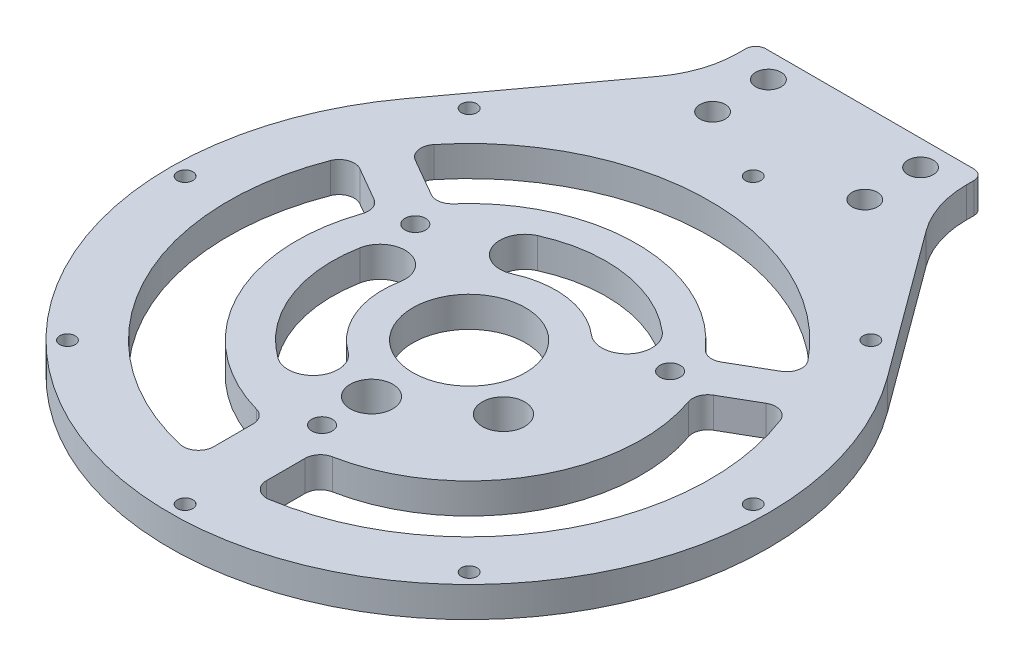
from build123d import *

# Parameters (mm, degrees)
SKETCH_1_R               = 59
SKETCH_1_R_2             = 11.1
EXTRUDE_1_DEPTH          = 6
SKETCH_2_R               = 1.525
CUT_EXTRUDE_1_DEPTH      = 6
EXTRUDE_START            = -6
EXTRUDE_2_DEPTH          = 6
SKETCH_4_R               = 4.2
SKETCH_4_R_2             = 2.025
CUT_EXTRUDE_2_DEPTH      = 6
SKETCH_5_R               = 4.2
CUT_EXTRUDE_3_DEPTH      = 6
CUT_EXTRUDE_4_DEPTH      = 10
CUT_EXTRUDE_5_DEPTH      = 10
CUT_EXTRUDE_7_DEPTH      = 10
FILLET_1_R               = 3
SKETCH_11_R              = 2.5
CUT_EXTRUDE_8_DEPTH      = 10
CUT_EXTRUDE_9_DEPTH      = 10
PATTERN_CIRCULAR_1_COUNT = 3
CUT_EXTRUDE_10_DEPTH     = 20
FILLET_3_R               = 20
FILLET_4_R               = 2


with BuildPart() as part:
    # 草图1 → 凸台-拉伸1 (new body)
    with BuildSketch(Plane(origin=(0, 0, 0), x_dir=(1, 0, 0), z_dir=(0, 1, 0))):
        with Locations(Location((0, 0, 0), (0, 0, 270))):
            Circle(SKETCH_1_R)
        with Locations(Location((0, 0, 0), (0, 0, 270))):
            Circle(SKETCH_1_R_2, mode=Mode.SUBTRACT)
    extrude(amount=EXTRUDE_1_DEPTH)

    # 草图2 → 切除-拉伸1 (cut)
    with BuildSketch(Plane(origin=(0, 6, 0), x_dir=(1, 0, 0), z_dir=(0, 1, 0))):
        with Locations(Location((0, 56, 0), (0, 0, 270))):
            Circle(SKETCH_2_R)
        with Locations(Location((39.597979746, 39.597979746, 0), (0, 0, 270))):
            Circle(SKETCH_2_R)
        with Locations(Location((56, 0, 0), (0, 0, 270))):
            Circle(SKETCH_2_R)
        with Locations(Location((39.597979746, -39.597979746, 0), (0, 0, 270))):
            Circle(SKETCH_2_R)
        with Locations(Location((0, -56, 0), (0, 0, 270))):
            Circle(SKETCH_2_R)
        with Locations(Location((-39.597979746, -39.597979746, 0), (0, 0, 270))):
            Circle(SKETCH_2_R)
        with Locations(Location((-56, 0, 0), (0, 0, 270))):
            Circle(SKETCH_2_R)
        with Locations(Location((-39.597979746, 39.597979746, 0), (0, 0, 270))):
            Circle(SKETCH_2_R)
    extrude(amount=-CUT_EXTRUDE_1_DEPTH, mode=Mode.SUBTRACT)

    # 草图3 → 凸台-拉伸2 (add)
    with BuildSketch(Plane(origin=(0, 6, 0), x_dir=(1, 0, 0), z_dir=(0, 1, 0)).offset(EXTRUDE_START)):
        with BuildLine():
            Line((-51.088050573, 29.512896989), (-22.5, 79))
            Line((-22.5, 79), (22.5, 79))
            Line((22.5, 79), (51.088050573, 29.512896989))
            ThreePointArc((51.088050573, 29.512896989), (0, 59), (-51.088050573, 29.512896989))
        make_face()
    extrude(amount=EXTRUDE_2_DEPTH)

    # 草图4 → 切除-拉伸2 (cut)
    with BuildSketch(Plane.XZ):
        with Locations(Location((0, 19.25, 0), (0, 0, 270))):
            Circle(SKETCH_4_R)
        with Locations(Location((0, 29, 0), (0, 0, 270))):
            Circle(SKETCH_4_R_2)
        with Locations(Location((25.11473671, -14.5, 0), (0, 0, 270))):
            Circle(SKETCH_4_R_2)
        with Locations(Location((-25.11473671, -14.5, 0), (0, 0, 270))):
            Circle(SKETCH_4_R_2)
    extrude(amount=-CUT_EXTRUDE_2_DEPTH, mode=Mode.SUBTRACT)

    # 草图5 → 切除-拉伸3 (cut)
    with BuildSketch(Plane.XZ):
        with Locations(Location((16.02146997, 9.25, 0), (0, 0, 270))):
            Circle(SKETCH_5_R)
    extrude(amount=-CUT_EXTRUDE_3_DEPTH, mode=Mode.SUBTRACT)

    # 草图8 → 切除-拉伸4 (cut)
    with BuildSketch(Plane.XZ):
        with BuildLine():
            Line((38.990090266, -27.129741264), (26.368115905, -19.842440969))
            ThreePointArc((26.368115905, -19.842440969), (0, -33), (-26.368115905, -19.842440969))
            Line((-26.368115905, -19.842440969), (-38.990090266, -27.129741264))
            ThreePointArc((-38.990090266, -27.129741264), (0, -47.5), (38.990090266, -27.129741264))
        make_face()
    extrude(amount=-CUT_EXTRUDE_4_DEPTH, mode=Mode.SUBTRACT)

    # 草图9 → 切除-拉伸5 (cut)
    with BuildSketch(Plane.XZ):
        with BuildLine():
            ThreePointArc((34, 0), (33.302950494, -6.849342188), (31.240383034, -13.417841401))
            Line((31.240383034, -13.417841401), (42.990090266, -20.201538034))
            ThreePointArc((42.990090266, -20.201538034), (46.35881409, -10.349413326), (47.5, 0))
            ThreePointArc((47.5, 0), (34.973204028, 32.142261899), (4, 47.331279298))
            Line((4, 47.331279298), (4, 33.763886032))
            ThreePointArc((4, 33.763886032), (25.416530054, 22.583179581), (34, 0))
        make_face()
    extrude(amount=-CUT_EXTRUDE_5_DEPTH, mode=Mode.SUBTRACT)

    # 草图10 → 切除-拉伸7 (cut)
    with BuildSketch(Plane.XZ):
        with BuildLine():
            Line((-42.990090266, -20.201538034), (-31.240383034, -13.417841401))
            ThreePointArc((-31.240383034, -13.417841401), (-30.175452448, 15.666590872), (-7, 33.271609519))
            Line((-7, 33.271609519), (-7, 46.98137929))
            ThreePointArc((-7, 46.98137929), (-41.870495295, 22.430149883), (-42.990090266, -20.201538034))
        make_face()
    extrude(amount=-CUT_EXTRUDE_7_DEPTH, mode=Mode.SUBTRACT)

    # 圆角1
    fillet_1_edges = [part.edges().sort_by_distance(p)[0] for p in [
        (42.990090266, 3, -20.201538034),
        (31.240383034, 3, -13.417841401),
        (4, 3, 33.763886032),
        (4, 3, 47.331279298),
        (-7, 3, 46.98137929),
        (-7, 3, 33.271609519),
        (-31.240383034, 3, -13.417841401),
        (-42.990090266, 3, -20.201538034),
        (-26.368115905, 3, -19.842440969),
        (26.368115905, 3, -19.842440969),
        (38.990090266, 3, -27.129741264),
        (-38.990090266, 3, -27.129741264),
    ]]
    fillet(fillet_1_edges, radius=FILLET_1_R)

    # 草图11 → 切除-拉伸8 (cut)
    with BuildSketch(Plane(origin=(0, 6, 0), x_dir=(1, 0, 0), z_dir=(0, 1, 0))):
        with Locations(Location((15, 63, 0), (0, 0, 270))):
            Circle(SKETCH_11_R)
        with Locations(Location((15, 74, 0), (0, 0, 270))):
            Circle(SKETCH_11_R)
        with Locations(Location((-15, 63, 0), (0, 0, 270))):
            Circle(SKETCH_11_R)
        with Locations(Location((-15, 74, 0), (0, 0, 270))):
            Circle(SKETCH_11_R)
    extrude(amount=-CUT_EXTRUDE_8_DEPTH, mode=Mode.SUBTRACT)

    # 草图12 → 切除-拉伸9 (cut)
    with BuildSketch(Plane.XZ):
        with BuildLine():
            ThreePointArc((-11.126662137, -24.600759941), (3.851051224, -26.723948145), (17.619884076, -20.458242475))
            ThreePointArc((17.619884076, -20.458242475), (18.140249782, -13.477252607), (11.159259915, -12.956886901))
            ThreePointArc((11.159259915, -12.956886901), (2.438999108, -16.925167159), (-7.04688602, -15.580481296))
            ThreePointArc((-7.04688602, -15.580481296), (-13.596913401, -18.05073256), (-11.126662137, -24.600759941))
        make_face()
    cut_extrude_9 = extrude(amount=-CUT_EXTRUDE_9_DEPTH, mode=Mode.SUBTRACT)

    # 阵列(圆周)1: 切除-拉伸9 ×3 about axis, 1 skipped
    pattern_circular_1_axis = Axis((0, 0, 0), (0, 1, 0))
    add([cut_extrude_9.rotate(pattern_circular_1_axis, i * 360 / PATTERN_CIRCULAR_1_COUNT) for i in range(1, PATTERN_CIRCULAR_1_COUNT) if i not in (2,)], mode=Mode.SUBTRACT)

    # 草图15 → 切除-拉伸10 (cut, symmetric)
    with BuildSketch(Plane.XZ):
        with BuildLine():
            Line((22.5, -79), (22.5, -69))
            Line((22.5, -69), (47.535137175, -34.948687153))
            ThreePointArc((47.535137175, -34.948687153), (49.386437856, -32.279711212), (51.088050573, -29.512896989))
            Line((51.088050573, -29.512896989), (22.5, -79))
        make_face()
        with BuildLine():
            Line((-22.5, -79), (-51.088050573, -29.512896989))
            ThreePointArc((-51.088050573, -29.512896989), (-49.386437856, -32.279711212), (-47.535137175, -34.948687153))
            Line((-47.535137175, -34.948687153), (-22.5, -69))
            Line((-22.5, -69), (-22.5, -79))
        make_face()
    extrude(amount=CUT_EXTRUDE_10_DEPTH, both=True, mode=Mode.SUBTRACT)

    # 圆角3
    fillet_3_edges = [part.edges().sort_by_distance(p)[0] for p in [
        (-22.5, 3, -69),
        (22.5, 3, -69),
    ]]
    fillet(fillet_3_edges, radius=FILLET_3_R)

    # 圆角4
    fillet_4_edges = [part.edges().sort_by_distance(p)[0] for p in [
        (-22.5, 3, -79),
        (22.5, 3, -79),
    ]]
    fillet(fillet_4_edges, radius=FILLET_4_R)


solid = part.part
